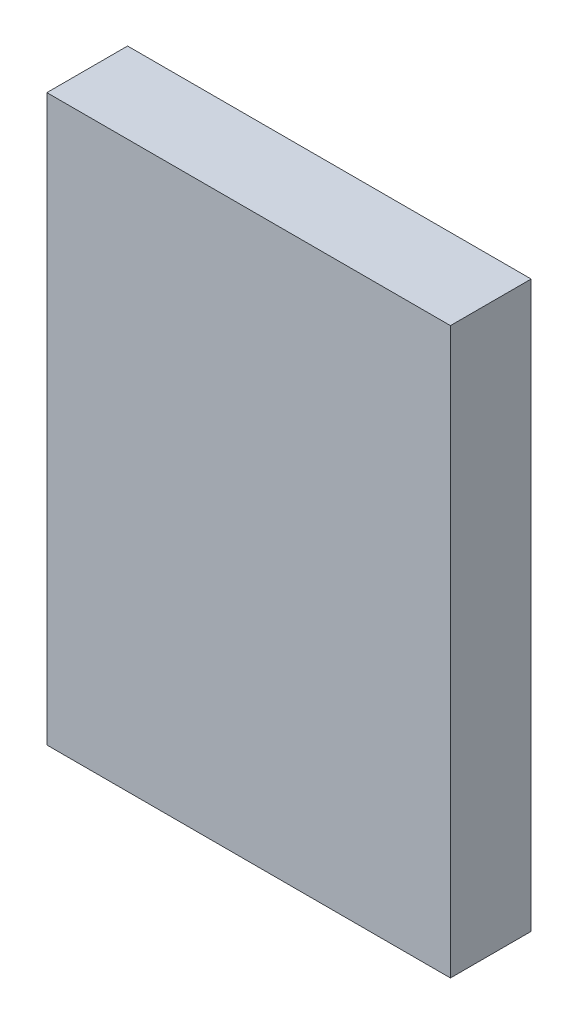
from build123d import *

# Parameters (mm, degrees)
SKETCH2_W           = 25
SKETCH2_H           = 35
BOSS_EXTRUDE1_DEPTH = 5


with BuildPart() as part:
    # Sketch2 → Boss-Extrude1 (new body)
    with BuildSketch(Plane.XY):
        Rectangle(SKETCH2_W, SKETCH2_H)
    extrude(amount=BOSS_EXTRUDE1_DEPTH)


solid = part.part
